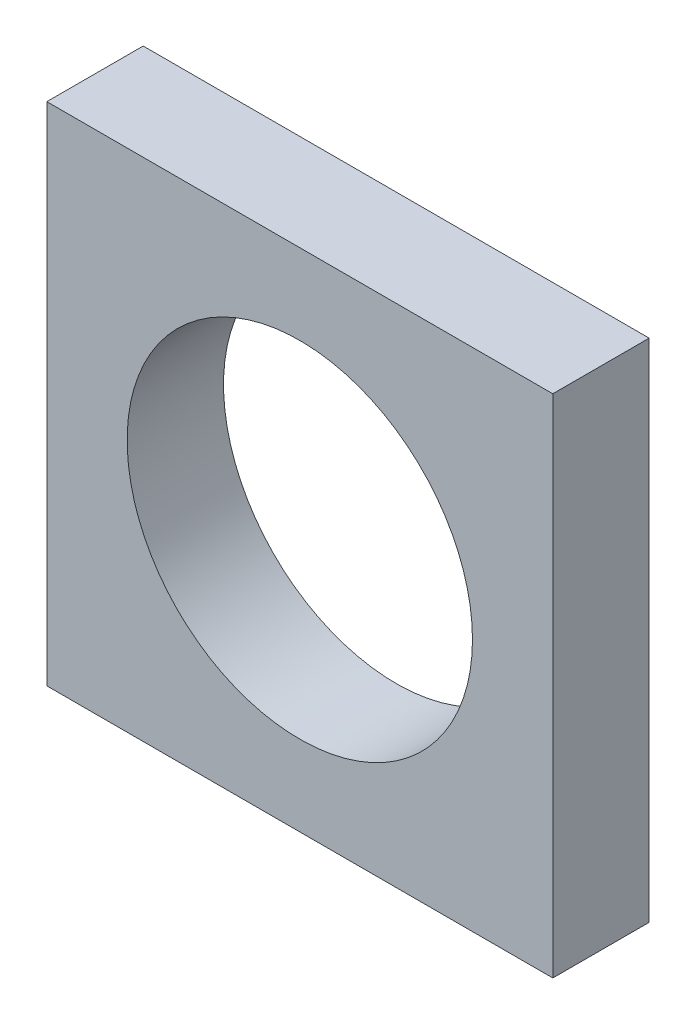
from build123d import *

# Parameters (mm, degrees)
ESQUISSE1_W        = 31.5
ESQUISSE1_H        = 31.5
ESQUISSE1_R        = 10.75
BOSS_EXTRU_1_DEPTH = 6


with BuildPart() as part:
    # Esquisse1 → Boss.-Extru.1 (new body)
    with BuildSketch(Plane.XY):
        with Locations((15.75, 15.75)):
            Rectangle(ESQUISSE1_W, ESQUISSE1_H)
        with Locations((15.75, 15.75)):
            Circle(ESQUISSE1_R, mode=Mode.SUBTRACT)
    extrude(amount=BOSS_EXTRU_1_DEPTH)


solid = part.part
